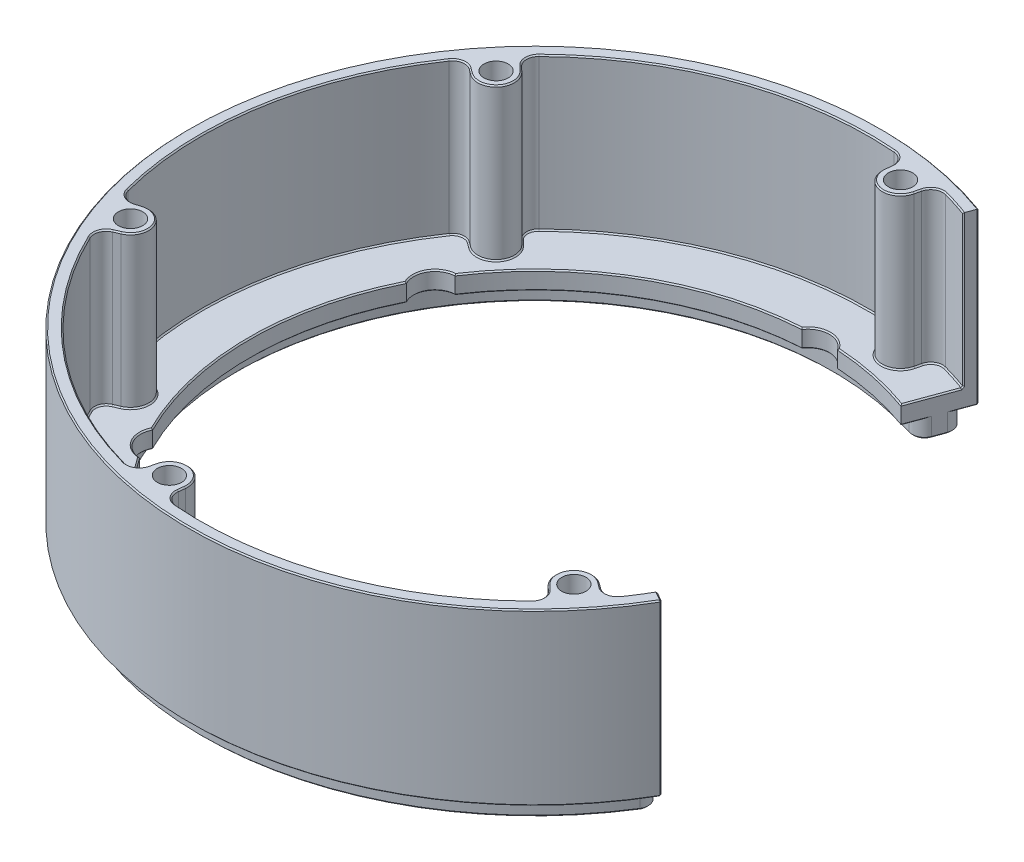
from build123d import *

# Parameters (mm, degrees)
SKETCH_7_R          = 2
SKETCH_7_R_2        = 2.0000000000000036
SKETCH_7_R_3        = 2.000000000000001
SKETCH_7_R_4        = 2.000000000000205
EXTRUDE_1_DEPTH     = 28
EXTRUDE_2_DEPTH     = 3
EXTRUDE_START       = -3
SKETCH_7_6_R        = 2
SKETCH_7_6_R_2      = 2.0000000000000036
SKETCH_7_6_R_3      = 2.000000000000001
SKETCH_7_6_R_4      = 2.000000000000205
EXTRUDE_3_DEPTH     = 3
SKETCH_8_R          = 3.5000000000001967
SKETCH_8_R_2        = 3.5000000000037352
SKETCH_8_R_3        = 3.500000000000297
SKETCH_8_R_4        = 3.50000000000053
SKETCH_8_R_5        = 3.500000000000412
CUT_EXTRUDE_1_DEPTH = 10
CHAMFER_1_SIZE      = 0.3
CHAMFER_2_SIZE      = 0.2


with BuildPart() as part:
    # 스케치7 → 보스-돌출1 (new body)
    with BuildSketch(Plane(origin=(0, 0, 0), x_dir=(1, 0, 0), z_dir=(0, 1, 0))):
        with BuildLine():
            Line((18.91177975344238, 51.646341463268975), (19.599480835439874, 53.52439024389932))
            ThreePointArc((19.599480835439874, 53.52439024389932), (-53.58144770023637, -19.442954054022614), (49.36344801571298, -28.50000000000002))
            Line((49.363448015713, -28.499999999999996), (47.63139720801256, -27.499999999924043))
            ThreePointArc((47.63139720801274, -27.49999999992374), (46.50734011443997, -29.360982876312118), (45.310612240666146, -31.176087284315923))
            ThreePointArc((45.31061224066615, -31.176087284315923), (43.98921539753693, -32.01562025402259), (42.46790937680476, -31.64611624113448))
            Line((42.46790937680476, -31.646116241134482), (41.62687739757175, -31.019398416596214))
            ThreePointArc((41.62687739757175, -31.019398416596207), (37.536177712829556, -31.49659287464087), (37.77657545649076, -35.608009587451804))
            Line((37.77657545649076, -35.60800958745181), (38.5398156996004, -36.32743599298926))
            ThreePointArc((38.5398156996004, -36.32743599298926), (39.16787813443557, -37.76146625843183), (38.57055771074326, -39.2085714846322))
            ThreePointArc((38.57055771074325, -39.2085714846322), (18.81110788285915, -51.68309414308246), (-4.343977458485652, -54.82818490360098))
            ThreePointArc((-4.343977458485655, -54.82818490360098), (-5.731732759130835, -54.10358815382384), (-6.172385907535519, -52.60134648649551))
            Line((-6.172385907535521, -52.60134648649551), (-6.050148340097366, -51.559632514815476))
            ThreePointArc((-6.050148340097367, -51.559632514815476), (-8.508760705680288, -48.25557989759808), (-11.949153152687858, -50.5194788070266))
            Line((-11.94915315268786, -50.5194788070266), (-12.190574574481795, -51.540177449518886))
            ThreePointArc((-12.190574574481797, -51.540177449518886), (-13.118449996733224, -52.80111060597014), (-14.670340096418125, -53.00736855795349))
            ThreePointArc((-14.670340096418132, -53.007368557953484), (-35.35331853266266, -42.13244437142687), (-49.65458969915178, -23.652097619284838))
            ThreePointArc((-49.6545896991518, -23.65209761928484), (-49.72094815666774, -22.08796789980104), (-48.640295284340255, -20.95523024536082))
            Line((-48.640295284340255, -20.95523024536082), (-47.67702573766909, -20.54023409821906))
            ThreePointArc((-47.67702573766909, -20.54023409821906), (-46.0449384185098, -16.758987022957005), (-49.725728609178574, -14.911469219574593))
            Line((-49.725728609178574, -14.911469219574588), (-50.730390274082154, -15.212741456529422))
            ThreePointArc((-50.730390274082154, -15.212741456529422), (-52.28632813116875, -15.039644347538093), (-53.24089780716133, -13.79879707332108))
            ThreePointArc((-53.240897807161325, -13.798797073321065), (-54.16442641552166, 9.550649771655797), (-45.31061224066591, 31.176087284316257))
            ThreePointArc((-45.31061224066592, 31.17608728431625), (-43.98921539753669, 32.01562025402291), (-42.46790937680451, 31.646116241134788))
            Line((-42.46790937680451, 31.646116241134788), (-41.62687739757151, 31.019398416596513))
            ThreePointArc((-41.62687739757151, 31.019398416596516), (-37.53617771282982, 31.496592874641582), (-37.77657545649049, 35.60800958745209))
            Line((-37.77657545649049, 35.60800958745209), (-38.53981569960015, 36.327435992989535))
            ThreePointArc((-38.53981569960015, 36.327435992989535), (-39.167878134435284, 37.76146625843212), (-38.57055771074297, 39.20857148463248))
            ThreePointArc((-38.570557710742975, 39.20857148463248), (-18.811107882859122, 51.683094143082464), (4.343977458485281, 54.828184903601006))
            ThreePointArc((4.343977458485274, 54.828184903601006), (5.731732759130461, 54.103588153823885), (6.172385907535157, 52.60134648649555))
            Line((6.172385907535156, 52.60134648649555), (6.0501483400970075, 51.55963251481552))
            ThreePointArc((6.050148340097012, 51.55963251481552), (8.508760705679954, 48.255579897598125), (11.949153152687511, 50.51947880702668))
            Line((11.94915315268751, 50.51947880702668), (12.190574574481436, 51.54017744951897))
            ThreePointArc((12.190574574481438, 51.54017744951897), (13.11844999673286, 52.80111060597022), (14.670340096417757, 53.00736855795359))
            ThreePointArc((14.670340096417755, 53.00736855795359), (16.804844304268986, 52.36981199023506), (18.911779753443135, 51.646341463268705))
        make_face()
        with Locations((9.02970523868077, 51.21000315663475)):
            Circle(SKETCH_7_R, mode=Mode.SUBTRACT)
        with Locations((-39.834311042186634, 33.42495570370032)):
            Circle(SKETCH_7_R_2, mode=Mode.SUBTRACT)
        with Locations((-48.86401628086737, -17.785047452934425)):
            Circle(SKETCH_7_R_2, mode=Mode.SUBTRACT)
        with Locations((-9.029705238680762, -51.21000315663475)):
            Circle(SKETCH_7_R_3, mode=Mode.SUBTRACT)
        with Locations((39.83431104218661, -33.42495570370034)):
            Circle(SKETCH_7_R_4, mode=Mode.SUBTRACT)
    extrude(amount=EXTRUDE_1_DEPTH)

    # 스케치7<5> → 보스-돌출2 (add)
    with BuildSketch(Plane(origin=(0, 0, 0), x_dir=(1, 0, 0), z_dir=(0, 1, 0))):
        with BuildLine():
            ThreePointArc((18.911779753443135, 51.646341463268705), (16.80484430426899, 52.369811990235064), (14.670340096417759, 53.0073685579536))
            ThreePointArc((14.670340096417757, 53.00736855795359), (13.11844999673286, 52.80111060597022), (12.190574574481438, 51.54017744951897))
            Line((12.190574574481436, 51.54017744951897), (11.94915315268751, 50.51947880702668))
            ThreePointArc((11.949153152687511, 50.51947880702668), (8.508760705679954, 48.25557989759813), (6.050148340097012, 51.55963251481552))
            Line((6.0501483400970075, 51.55963251481552), (6.172385907535156, 52.60134648649555))
            ThreePointArc((6.172385907535157, 52.60134648649555), (5.731732759130461, 54.103588153823885), (4.343977458485274, 54.828184903601006))
            ThreePointArc((4.343977458485281, 54.828184903601006), (-18.811107882859122, 51.683094143082464), (-38.570557710742975, 39.20857148463248))
            ThreePointArc((-38.57055771074297, 39.20857148463248), (-39.167878134435284, 37.76146625843212), (-38.53981569960015, 36.327435992989535))
            Line((-38.53981569960015, 36.327435992989535), (-37.77657545649049, 35.60800958745209))
            ThreePointArc((-37.77657545649049, 35.60800958745209), (-37.53617771282982, 31.496592874641582), (-41.62687739757151, 31.019398416596516))
            Line((-41.62687739757151, 31.019398416596513), (-42.46790937680451, 31.646116241134788))
            ThreePointArc((-42.46790937680451, 31.646116241134788), (-43.98921539753669, 32.01562025402291), (-45.31061224066592, 31.17608728431625))
            ThreePointArc((-45.31061224066591, 31.176087284316257), (-54.16442641552166, 9.550649771655797), (-53.240897807161325, -13.798797073321065))
            ThreePointArc((-53.24089780716133, -13.79879707332108), (-52.28632813116875, -15.039644347538093), (-50.730390274082154, -15.212741456529422))
            Line((-50.730390274082154, -15.212741456529422), (-49.725728609178574, -14.911469219574588))
            ThreePointArc((-49.725728609178574, -14.911469219574593), (-46.0449384185098, -16.758987022957005), (-47.67702573766909, -20.540234098219063))
            Line((-47.67702573766909, -20.54023409821906), (-48.640295284340255, -20.95523024536082))
            ThreePointArc((-48.640295284340255, -20.95523024536082), (-49.72094815666774, -22.08796789980104), (-49.6545896991518, -23.65209761928484))
            ThreePointArc((-49.65458969915178, -23.652097619284838), (-35.35331853266266, -42.13244437142687), (-14.670340096418132, -53.007368557953484))
            ThreePointArc((-14.670340096418125, -53.00736855795349), (-13.118449996733224, -52.80111060597014), (-12.190574574481797, -51.540177449518886))
            Line((-12.190574574481795, -51.540177449518886), (-11.94915315268786, -50.5194788070266))
            ThreePointArc((-11.94915315268786, -50.5194788070266), (-8.508760705680292, -48.25557989759808), (-6.050148340097367, -51.559632514815476))
            Line((-6.050148340097366, -51.559632514815476), (-6.172385907535521, -52.60134648649551))
            ThreePointArc((-6.172385907535519, -52.60134648649551), (-5.731732759130835, -54.10358815382384), (-4.343977458485655, -54.82818490360098))
            ThreePointArc((-4.343977458485652, -54.82818490360098), (18.81110788285915, -51.68309414308246), (38.57055771074325, -39.2085714846322))
            ThreePointArc((38.57055771074326, -39.2085714846322), (39.16787813443557, -37.76146625843183), (38.5398156996004, -36.32743599298926))
            Line((38.5398156996004, -36.32743599298926), (37.77657545649076, -35.60800958745181))
            ThreePointArc((37.77657545649076, -35.608009587451804), (37.536177712829556, -31.49659287464087), (41.62687739757175, -31.019398416596207))
            Line((41.62687739757175, -31.019398416596214), (42.46790937680476, -31.646116241134482))
            ThreePointArc((42.46790937680476, -31.64611624113448), (43.98921539753693, -32.01562025402259), (45.31061224066615, -31.176087284315923))
            ThreePointArc((45.310612240666146, -31.17608728431592), (46.50734011443996, -29.360982876312114), (47.63139720801274, -27.499999999923737))
            Line((47.631397208012736, -27.499999999923737), (40.7031939778686, -23.500000000000007))
            ThreePointArc((40.70319397786861, -23.500000000000025), (-44.18119371773877, -16.031909483141458), (16.160975425713584, 44.13414634146085))
            Line((16.16097542571358, 44.13414634146084), (18.911779753443135, 51.6463414632687))
        make_face()
    extrude(amount=EXTRUDE_2_DEPTH)

    # 스케치7<6> → 보스-돌출3 (add)
    with BuildSketch(Plane(origin=(0, 0, 0), x_dir=(1, 0, 0), z_dir=(0, 1, 0)).offset(EXTRUDE_START)):
        with BuildLine():
            Line((17.522888066385065, 47.85340524782891), (18.211098556836365, 49.73284517637302))
            ThreePointArc((18.211098556836365, 49.73284517637302), (18.131101806303032, 51.29633669990632), (16.94939127734473, 52.323208381279144))
            ThreePointArc((16.94939127734473, 52.323208381279144), (-51.701396903594045, -18.760745139794572), (46.559735858064606, -29.277824318253952))
            ThreePointArc((46.55973585806461, -29.27782431825395), (46.80793068133317, -27.73208677456839), (45.866654554130314, -26.48112535365471))
            Line((45.866654554130314, -26.481125353654715), (44.13332074521472, -25.48038461248182))
            ThreePointArc((44.13332074521472, -25.480384612481817), (42.653668941164284, -25.270803594273428), (41.441817970892565, -26.145281089852627))
            ThreePointArc((41.44181797089257, -26.14528108985263), (-46.06124451423828, -16.71411839731769), (15.031316176646504, 46.637533532528124))
            ThreePointArc((15.031316176646493, 46.63753353252812), (16.521960885404162, 46.743703286581386), (17.522888066385065, 47.85340524782891))
        make_face()
        with Locations((9.02970523868077, 51.21000315663475)):
            Circle(SKETCH_7_6_R, mode=Mode.SUBTRACT)
        with Locations((-39.834311042186634, 33.42495570370032)):
            Circle(SKETCH_7_6_R_2, mode=Mode.SUBTRACT)
        with Locations((-48.86401628086737, -17.785047452934425)):
            Circle(SKETCH_7_6_R_2, mode=Mode.SUBTRACT)
        with Locations((-9.029705238680762, -51.21000315663475)):
            Circle(SKETCH_7_6_R_3, mode=Mode.SUBTRACT)
        with Locations((39.83431104218661, -33.42495570370034)):
            Circle(SKETCH_7_6_R_4, mode=Mode.SUBTRACT)
    extrude(amount=EXTRUDE_3_DEPTH)

    # 스케치8 → 컷-돌출1 (cut)
    with BuildSketch(Plane(origin=(0, 0, 0), x_dir=(1, 0, 0), z_dir=(0, 1, 0))):
        with Locations((38.97114317029974, -22.499999999999996)):
            Circle(SKETCH_8_R)
        with Locations((-3.73412e-12, 45.00000000000007)):
            Circle(SKETCH_8_R_2)
        with Locations((-7.66e-15, -45)):
            Circle(SKETCH_8_R_3)
        with Locations((-38.97114317029976, 22.49999999999997)):
            Circle(SKETCH_8_R_4)
        with Locations((-38.97114317029974, -22.500000000000014)):
            Circle(SKETCH_8_R_5)
    extrude(amount=CUT_EXTRUDE_1_DEPTH, mode=Mode.SUBTRACT)

    # 모따기1
    chamfer_1_edges = [part.edges().sort_by_distance(p)[0] for p in [
        (42.653668941164284, -3, 25.270803594273428),
        (44.99998764967252, -3, 25.980754983068266),
        (46.80793068133317, -3, 27.73208677456839),
        (-46.06124451423828, -3, 16.71411839731769),
        (16.521960885404162, -3, -46.743703286581386),
        (-51.701396903594045, -3, 18.760745139794558),
        (17.866993311610713, -3, -48.79312521210096),
        (18.131101806303032, -3, -51.29633669990632),
    ]]
    chamfer(chamfer_1_edges, length=CHAMFER_1_SIZE)

    # 모따기2
    chamfer_2_edges = [part.edges().sort_by_distance(p)[0] for p in [
        (18.911779753442758, 15.5, -51.64634146326884),
        (17.536377589578358, 3, -47.89024390236477),
        (9.647714761774347, 3, -45.99914781683941),
        (-4.03941e-12, 3, -48.50000000000381),
        (-23.5000000000034, 3, -40.70319397786667),
        (-42.002232083545756, 3, -24.250000000000234),
        (-47.000000000000014, 3, 1.4477e-13),
        (-42.002232083545636, 3, 24.250000000000217),
        (-23.49999999999996, 3, 40.70319397786865),
        (-7.45e-15, 3, 48.5000000000003),
        (23.500000000000053, 3, 40.703193977868594),
        (40.80095409517384, 3, 25.48358709931732),
        (44.81681464577909, 3, 25.874999999961886),
        (47.63139720801265, 15.5, 27.499999999923894),
        (43.06777641438008, 0, 24.865192306240974),
        (40.800954095173886, 0, 25.483587099317294),
        (23.500000000000043, 0, 40.7031939778686),
        (-9.534e-14, 0, 48.5000000000003),
        (-23.500000000000007, 0, 40.70319397786863),
        (-42.00223208354567, 0, 24.25000000000015),
        (-47.000000000000014, 0, 5.596e-14),
        (-42.00223208354578, 0, -24.2500000000002),
        (-23.500000000003528, 0, -40.70319397786659),
        (-4.10228e-12, 0, -48.50000000000381),
        (9.647714761774347, 0, -45.99914781683941),
        (16.841931746049315, 0, -45.99377579464488),
        (47.61505128492164, 0, 27.49056267682737),
        (18.90528969613812, 0, -51.628617710136176),
        (19.599480835439877, 14, -53.524390243899326),
        (-53.58144770023638, 28, 19.442954054022586),
        (49.36344801571298, 14, 28.50000000000001),
        (-53.58144770023638, 0, 19.442954054022586),
        (16.804844304268983, 28, -52.36981199023505),
        (13.11844999673286, 28, -52.80111060597022),
        (12.069863863584473, 28, -51.029828128272825),
        (8.50876070567995, 28, -48.255579897598125),
        (6.111267123816082, 28, -52.08048950065553),
        (5.731732759130462, 28, -54.103588153823885),
        (-18.811107882859115, 28, -51.683094143082464),
        (-39.167878134435284, 28, -37.76146625843212),
        (-38.15819557804532, 28, -35.96772279022081),
        (-37.53617771282982, 28, -31.496592874641575),
        (-42.04739338718801, 28, -31.33275732886565),
        (-43.98921539753669, 28, -32.01562025402291),
        (-54.164426415521675, 28, -9.550649771655781),
        (-52.28632813116875, 28, 15.039644347538095),
        (-50.228059441630364, 28, 15.062105338052005),
        (-46.0449384185098, 28, 16.758987022957),
        (-48.15866051100467, 28, 20.747732171789938),
        (-49.72094815666774, 28, 22.08796789980104),
        (-35.353318532662676, 28, 42.13244437142686),
        (-13.118449996733224, 28, 52.80111060597014),
        (-12.069863863584828, 28, 51.02982812827274),
        (-8.508760705680288, 28, 48.25557989759808),
        (-6.111267123816443, 28, 52.08048950065549),
        (-5.731732759130834, 28, 54.10358815382384),
        (18.811107882859133, 28, 51.68309414308247),
        (39.16787813443557, 28, 37.76146625843183),
        (38.15819557804558, 28, 35.967722790220535),
        (37.536177712829556, 28, 31.49659287464087),
        (42.04739338718825, 28, 31.33275732886535),
        (43.98921539753693, 28, 32.01562025402259),
        (46.50734011443996, 28, 29.36098287631212),
        (48.497422611862774, 28, 27.99999999996202),
        (-6.111267123816443, 3, 52.08048950065549),
        (-8.508760705680292, 3, 48.25557989759808),
        (-12.069863863584828, 3, 51.02982812827274),
        (-13.118449996733224, 3, 52.80111060597014),
        (-35.35331853266268, 3, 42.13244437142687),
        (-49.72094815666774, 3, 22.08796789980104),
        (-48.15866051100467, 3, 20.74773217178994),
        (-46.0449384185098, 3, 16.758987022957005),
        (-50.228059441630364, 3, 15.062105338052005),
        (-52.28632813116875, 3, 15.039644347538097),
        (-54.16442641552166, 3, -9.55064977165579),
        (-43.98921539753669, 3, -32.01562025402291),
        (-42.04739338718801, 3, -31.33275732886565),
        (-37.53617771282982, 3, -31.496592874641575),
        (-38.15819557804532, 3, -35.96772279022081),
        (-39.167878134435284, 3, -37.76146625843212),
        (-18.81110788285912, 3, -51.68309414308248),
        (5.731732759130462, 3, -54.103588153823885),
        (6.111267123816082, 3, -52.08048950065553),
        (8.508760705679956, 3, -48.25557989759813),
        (12.069863863584473, 3, -51.029828128272825),
        (13.11844999673286, 3, -52.80111060597022),
        (16.80484430426899, 3, -52.36981199023507),
        (-5.731732759130834, 3, 54.10358815382384),
        (18.811107882859126, 3, 51.683094143082464),
        (39.16787813443557, 3, 37.76146625843183),
        (38.15819557804558, 3, 35.967722790220535),
        (37.536177712829556, 3, 31.496592874640875),
        (42.04739338718825, 3, 31.33275732886535),
        (43.98921539753693, 3, 32.01562025402259),
        (46.50734011443998, 3, 29.360982876312118),
    ]]
    chamfer(chamfer_2_edges, length=CHAMFER_2_SIZE)


solid = part.part
